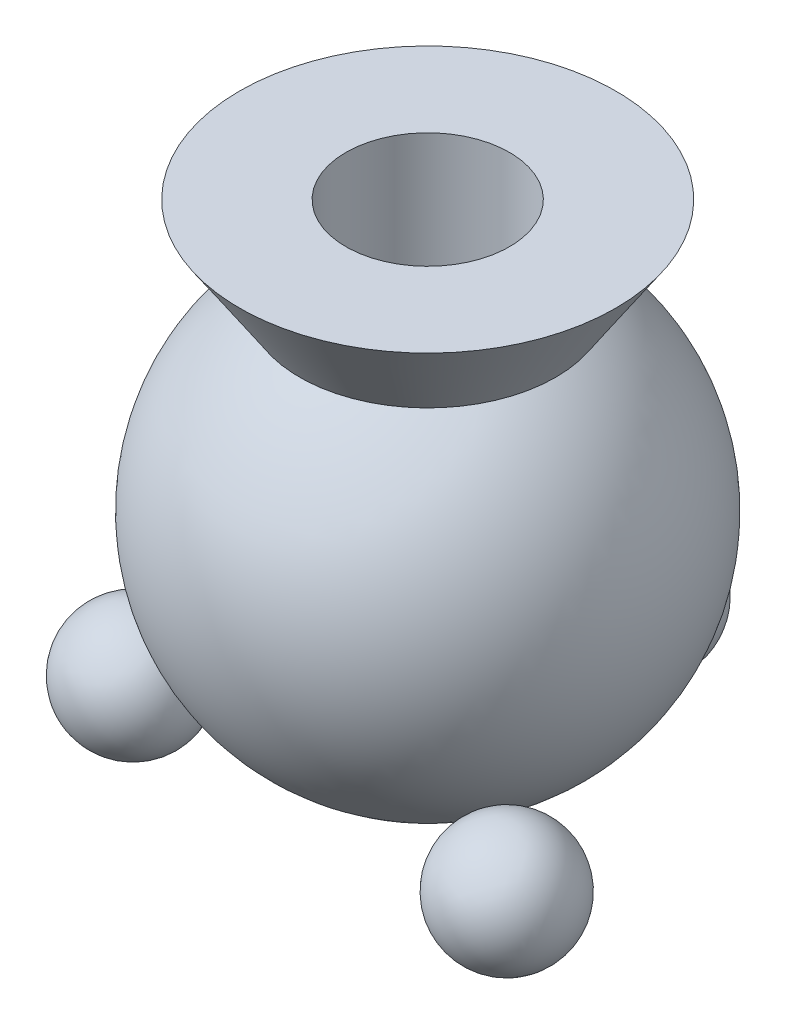
from build123d import *

# Parameters (mm, degrees)
CIRPATTERN2_COUNT = 3


with BuildPart() as part:
    # Sketch1 → Revolve1 (revolve)
    with BuildSketch(Plane.XY, mode=Mode.PRIVATE) as revolve1_sk:
        with BuildLine():
            Line((0, 35), (0, 0))
            ThreePointArc((0, 0), (25.719642299, 18.784161637), (15.652475842, 49))
            Line((15.652475842, 49), (23, 60))
            Line((23, 60), (10, 60))
            Line((10, 60), (10, 35))
            Line((10, 35), (0, 35))
        make_face()
    revolve(revolve1_sk.sketch.rotate(Axis((0, 35, 0), (0, -1, 0)), 180), axis=Axis((0, 35, 0), (0, -1, 0)))


with BuildPart() as body_2:
    # Sketch4 → Revolve5 (revolve)
    with BuildSketch(Plane(origin=(0, 0, 0), x_dir=(0, 0, -1), z_dir=(1, 0, 0))):
        with BuildLine():
            Line((20.647610737, 9.602409051), (32.118505592, -0.062919254))
            ThreePointArc((32.118505592, -0.062919254), (31.215722317, 10.505192325), (20.647610737, 9.602409051))
        make_face()
    revolve(axis=Axis((0, 26.359712992, -0.759898134), (0, -0.6443552203384815, -0.7647263236103143)))


with BuildPart() as cirpattern2_1:
    # CirPattern2: pattern copy
    add(body_2.part.rotate(Axis((0, 0, 0), (0, 1, 0)), 1 * 360 / CIRPATTERN2_COUNT))


with BuildPart() as cirpattern2_2:
    # CirPattern2: pattern copy
    add(body_2.part.rotate(Axis((0, 0, 0), (0, 1, 0)), 2 * 360 / CIRPATTERN2_COUNT))


solid = Compound([part.part, body_2.part, cirpattern2_1.part, cirpattern2_2.part])
